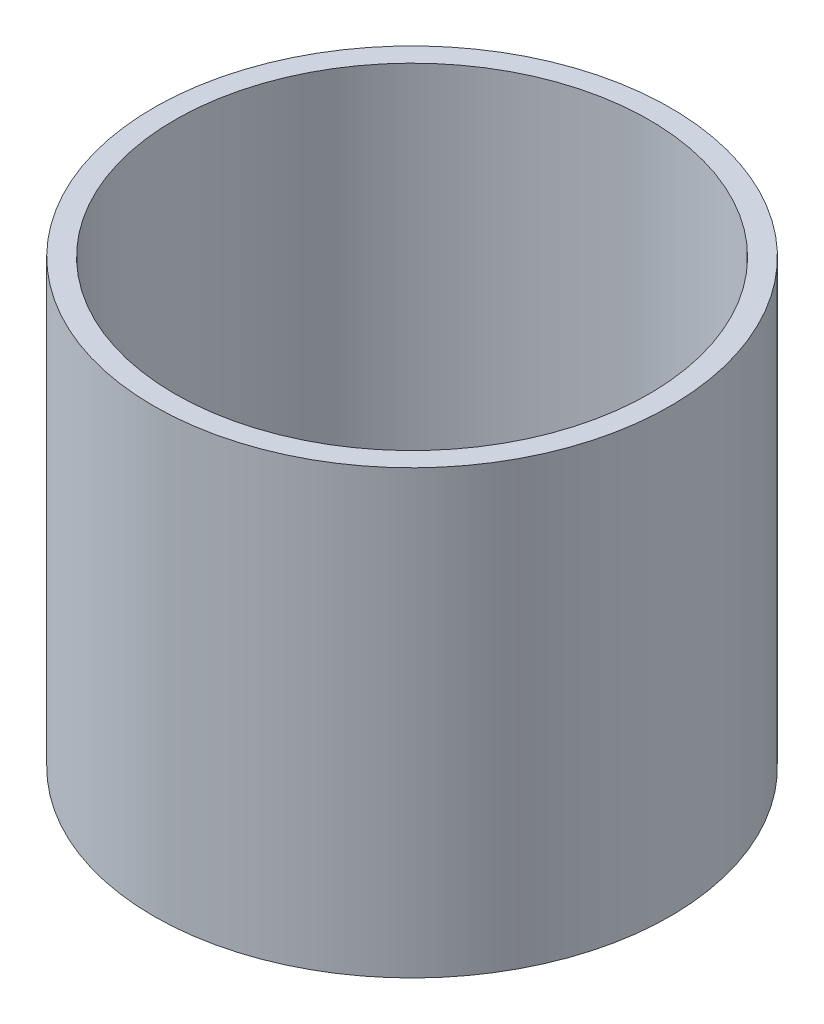
from build123d import *

# Parameters (mm, degrees)
SKETCH1_R           = 24.5
SKETCH1_R_2         = 22.5
BOSS_EXTRUDE1_DEPTH = 41.9


with BuildPart() as part:
    # Sketch1 → Boss-Extrude1 (new body)
    with BuildSketch(Plane(origin=(0, 0, 0), x_dir=(1, 0, 0), z_dir=(0, 1, 0))):
        with Locations(Location((0, 0, 0), (0, 0, 270))):
            Circle(SKETCH1_R)
        with Locations(Location((0, 0, 0), (0, 0, 270))):
            Circle(SKETCH1_R_2, mode=Mode.SUBTRACT)
    extrude(amount=BOSS_EXTRUDE1_DEPTH)


solid = part.part
